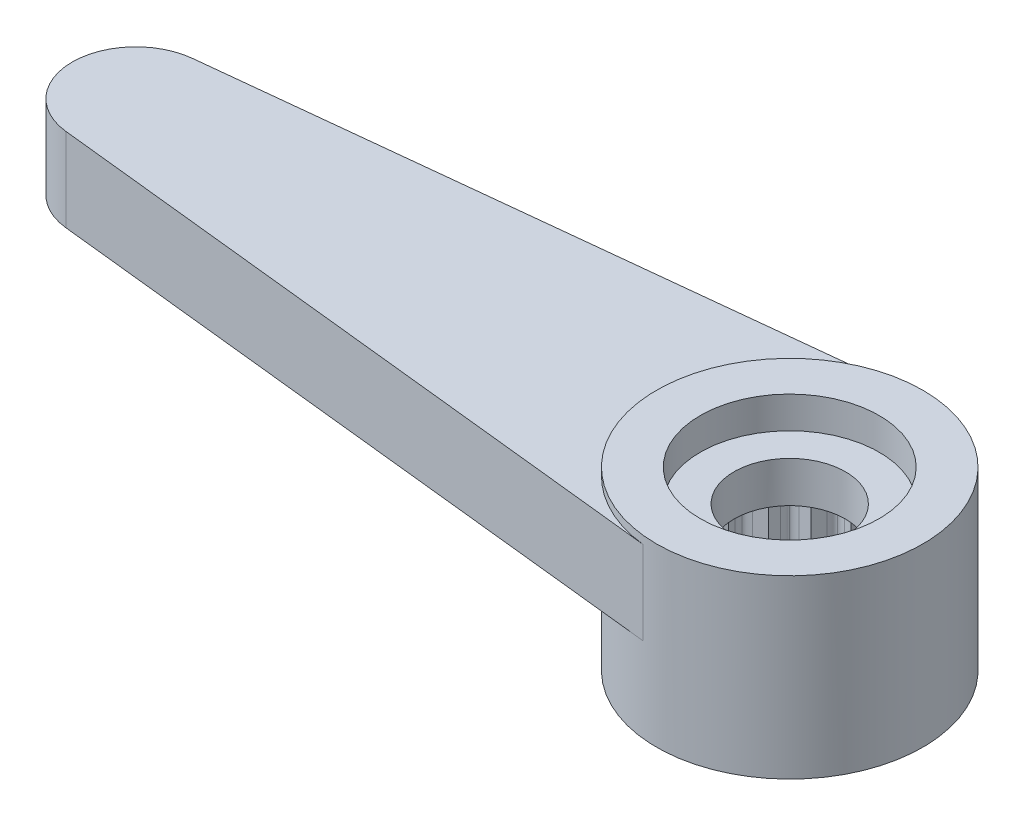
from build123d import *
from build123d.topology import SkipClean

# Parameters (mm, degrees)
BOSS_EXTRUDE1_DEPTH     = 2.1
SKETCH2_R               = 3.35
BOSS_EXTRUDE2_DEPTH     = 0.2
SKETCH3_R               = 2.25
CUT_EXTRUDE1_DEPTH      = 0.8
BOSS_EXTRUDE3_START     = 2.13
SKETCH4_R               = 3.35
BOSS_EXTRUDE3_DEPTH     = 2.13
CUT_EXTRUDE2_DEPTH      = 2.6
CUT_EXTRUDE3_DEPTH      = 14.236835148
CUT_EXTRUDE3_DEPTH_BACK = 14.236835148
SKETCH6_R               = 1.4


with BuildPart() as part:
    # Sketch1 → Boss-Extrude1 (new body)
    with BuildSketch(Plane(origin=(0, 0, 0), x_dir=(1, 0, 0), z_dir=(0, 1, 0))):
        with BuildLine():
            Line((8.51917837, 3.135210257), (-7.744651418, 1.395141105))
            ThreePointArc((-7.744651418, 1.395141105), (-9.174438652, -0.195779262), (-7.744651418, -1.786699629))
            Line((-7.744651418, -1.786699629), (8.51917837, -3.52676878))
            ThreePointArc((8.51917837, -3.52676878), (12.225561348, -0.195779262), (8.51917837, 3.135210257))
        make_face()
    extrude(amount=BOSS_EXTRUDE1_DEPTH)

    # Sketch2 → Boss-Extrude2 (add)
    with BuildSketch(Plane(origin=(0, 2.1, 0), x_dir=(1, 0, 0), z_dir=(0, 1, 0))):
        with Locations(Location((8.875561348, -0.195779262, 0), (0, 0, 96.10685173))):
            Circle(SKETCH2_R)
    extrude(amount=BOSS_EXTRUDE2_DEPTH)

    # Sketch3 → Cut-Extrude1 (cut)
    with BuildSketch(Plane(origin=(0, 2.3, 0), x_dir=(1, 0, 0), z_dir=(0, 1, 0))):
        with Locations(Location((8.875561348, -0.195779262, 0), (0, 0, 270))):
            Circle(SKETCH3_R)
    extrude(amount=-CUT_EXTRUDE1_DEPTH, mode=Mode.SUBTRACT)

    # Sketch4 → Boss-Extrude3 (add)
    with SkipClean():  # the faces are left unmerged after this step: merging them gives an invalid solid
        with BuildSketch(Plane.XZ.offset(BOSS_EXTRUDE3_START)):
            with Locations(Location((8.875561348, 0.195779262, 0), (0, 0, 270))):
                Circle(SKETCH4_R)
        extrude(amount=-BOSS_EXTRUDE3_DEPTH)

    # Sketch5 → Cut-Extrude2 (cut)
    with SkipClean():  # the faces are left unmerged after this step: merging them gives an invalid solid
        with BuildSketch(Plane.XZ.offset(2.13)):
            with BuildLine():
                Line((8.133920562, 2.478314901), (8.301821735, 2.77579771))
                add(Edge.make_bspline(
                    [(8.301821735, 2.77579771), (8.378769734, 2.912132117), (8.445670161, 2.910005398)],
                    knots=[0, 0, 0, 1, 1, 1], degree=2))
                add(Edge.make_bspline(
                    [(8.6239506, 2.82681791), (8.508639056, 2.932701397), (8.445670161, 2.910005398)],
                    knots=[0, 0, 0, 1, 1, 1], degree=2))
                Line((8.6239506, 2.82681791), (8.875561348, 2.595779262))
                Line((8.875561348, 2.595779262), (9.127172097, 2.82681791))
                add(Edge.make_bspline(
                    [(9.127172097, 2.82681791), (9.242483641, 2.932701397), (9.305452536, 2.910005398)],
                    knots=[0, 0, 0, 1, 1, 1], degree=2))
                add(Edge.make_bspline(
                    [(9.449300962, 2.77579771), (9.372352963, 2.912132117), (9.305452536, 2.910005398)],
                    knots=[0, 0, 0, 1, 1, 1], degree=2))
                Line((9.449300962, 2.77579771), (9.617202135, 2.478314901))
                Line((9.617202135, 2.478314901), (9.927893046, 2.620293716))
                add(Edge.make_bspline(
                    [(9.927893046, 2.620293716), (10.070280638, 2.685361669), (10.123154166, 2.644318033)],
                    knots=[0, 0, 0, 1, 1, 1], degree=2))
                add(Edge.make_bspline(
                    [(10.218489692, 2.472227329), (10.187437445, 2.625667294), (10.123154166, 2.644318033)],
                    knots=[0, 0, 0, 1, 1, 1], degree=2))
                Line((10.218489692, 2.472227329), (10.286245954, 2.137420048))
                Line((10.286245954, 2.137420048), (10.625604436, 2.176441154))
                add(Edge.make_bspline(
                    [(10.625604436, 2.176441154), (10.781130186, 2.194324269), (10.818732719, 2.138950633)],
                    knots=[0, 0, 0, 1, 1, 1], degree=2))
                add(Edge.make_bspline(
                    [(10.85622324, 1.945822349), (10.874106355, 2.1013481), (10.818732719, 2.138950633)],
                    knots=[0, 0, 0, 1, 1, 1], degree=2))
                Line((10.85622324, 1.945822349), (10.817202135, 1.606463867))
                Line((10.817202135, 1.606463867), (11.152009415, 1.538707606))
                add(Edge.make_bspline(
                    [(11.152009415, 1.538707606), (11.30544938, 1.507655359), (11.32410012, 1.44337208)],
                    knots=[0, 0, 0, 1, 1, 1], degree=2))
                add(Edge.make_bspline(
                    [(11.300075802, 1.248110959), (11.365143755, 1.390498551), (11.32410012, 1.44337208)],
                    knots=[0, 0, 0, 1, 1, 1], degree=2))
                Line((11.300075802, 1.248110959), (11.158096987, 0.937420048))
                Line((11.158096987, 0.937420048), (11.455579797, 0.769518875))
                add(Edge.make_bspline(
                    [(11.455579797, 0.769518875), (11.591914203, 0.692570876), (11.589787485, 0.625670449)],
                    knots=[0, 0, 0, 1, 1, 1], degree=2))
                add(Edge.make_bspline(
                    [(11.506599997, 0.44739001), (11.612483483, 0.562701554), (11.589787485, 0.625670449)],
                    knots=[0, 0, 0, 1, 1, 1], degree=2))
                Line((11.506599997, 0.44739001), (11.275561348, 0.195779262))
                Line((11.275561348, 0.195779262), (11.506599997, -0.055831487))
                add(Edge.make_bspline(
                    [(11.506599997, -0.055831487), (11.612483483, -0.171143031), (11.589787485, -0.234111926)],
                    knots=[0, 0, 0, 1, 1, 1], degree=2))
                add(Edge.make_bspline(
                    [(11.455579797, -0.377960351), (11.591914203, -0.301012353), (11.589787485, -0.234111926)],
                    knots=[0, 0, 0, 1, 1, 1], degree=2))
                Line((11.455579797, -0.377960351), (11.158096987, -0.545861525))
                Line((11.158096987, -0.545861525), (11.300075802, -0.856552435))
                add(Edge.make_bspline(
                    [(11.300075802, -0.856552435), (11.365143755, -0.998940028), (11.32410012, -1.051813556)],
                    knots=[0, 0, 0, 1, 1, 1], degree=2))
                add(Edge.make_bspline(
                    [(11.152009415, -1.147149082), (11.30544938, -1.116096835), (11.32410012, -1.051813556)],
                    knots=[0, 0, 0, 1, 1, 1], degree=2))
                Line((11.152009415, -1.147149082), (10.817202135, -1.214905344))
                Line((10.817202135, -1.214905344), (10.85622324, -1.554263826))
                add(Edge.make_bspline(
                    [(10.85622324, -1.554263826), (10.874106355, -1.709789576), (10.818732719, -1.747392109)],
                    knots=[0, 0, 0, 1, 1, 1], degree=2))
                add(Edge.make_bspline(
                    [(10.625604436, -1.78488263), (10.781130186, -1.802765745), (10.818732719, -1.747392109)],
                    knots=[0, 0, 0, 1, 1, 1], degree=2))
                Line((10.625604436, -1.78488263), (10.286245954, -1.745861525))
                Line((10.286245954, -1.745861525), (10.218489692, -2.080668805))
                add(Edge.make_bspline(
                    [(10.218489692, -2.080668805), (10.187437445, -2.23410877), (10.123154166, -2.252759509)],
                    knots=[0, 0, 0, 1, 1, 1], degree=2))
                add(Edge.make_bspline(
                    [(9.927893046, -2.228735192), (10.070280638, -2.293803145), (10.123154166, -2.252759509)],
                    knots=[0, 0, 0, 1, 1, 1], degree=2))
                Line((9.927893046, -2.228735192), (9.617202135, -2.086756377))
                Line((9.617202135, -2.086756377), (9.449300962, -2.384239187))
                add(Edge.make_bspline(
                    [(9.449300962, -2.384239187), (9.372352963, -2.520573593), (9.305452536, -2.518446875)],
                    knots=[0, 0, 0, 1, 1, 1], degree=2))
                add(Edge.make_bspline(
                    [(9.127172097, -2.435259387), (9.242483641, -2.541142873), (9.305452536, -2.518446875)],
                    knots=[0, 0, 0, 1, 1, 1], degree=2))
                Line((9.127172097, -2.435259387), (8.875561348, -2.204220738))
                Line((8.875561348, -2.204220738), (8.6239506, -2.435259387))
                add(Edge.make_bspline(
                    [(8.6239506, -2.435259387), (8.508639056, -2.541142873), (8.445670161, -2.518446875)],
                    knots=[0, 0, 0, 1, 1, 1], degree=2))
                add(Edge.make_bspline(
                    [(8.301821735, -2.384239187), (8.378769734, -2.520573593), (8.445670161, -2.518446875)],
                    knots=[0, 0, 0, 1, 1, 1], degree=2))
                Line((8.301821735, -2.384239187), (8.133920562, -2.086756377))
                Line((8.133920562, -2.086756377), (7.823229651, -2.228735192))
                add(Edge.make_bspline(
                    [(7.823229651, -2.228735192), (7.680842059, -2.293803145), (7.62796853, -2.252759509)],
                    knots=[0, 0, 0, 1, 1, 1], degree=2))
                add(Edge.make_bspline(
                    [(7.532633004, -2.080668805), (7.563685251, -2.23410877), (7.62796853, -2.252759509)],
                    knots=[0, 0, 0, 1, 1, 1], degree=2))
                Line((7.532633004, -2.080668805), (7.464876743, -1.745861525))
                Line((7.464876743, -1.745861525), (7.125518261, -1.78488263))
                add(Edge.make_bspline(
                    [(7.125518261, -1.78488263), (6.96999251, -1.802765745), (6.932389977, -1.747392109)],
                    knots=[0, 0, 0, 1, 1, 1], degree=2))
                add(Edge.make_bspline(
                    [(6.894899456, -1.554263826), (6.877016341, -1.709789576), (6.932389977, -1.747392109)],
                    knots=[0, 0, 0, 1, 1, 1], degree=2))
                Line((6.894899456, -1.554263826), (6.933920562, -1.214905344))
                Line((6.933920562, -1.214905344), (6.599113282, -1.147149082))
                add(Edge.make_bspline(
                    [(6.599113282, -1.147149082), (6.445673317, -1.116096835), (6.427022577, -1.051813556)],
                    knots=[0, 0, 0, 1, 1, 1], degree=2))
                add(Edge.make_bspline(
                    [(6.451046894, -0.856552435), (6.385978941, -0.998940028), (6.427022577, -1.051813556)],
                    knots=[0, 0, 0, 1, 1, 1], degree=2))
                Line((6.451046894, -0.856552435), (6.593025709, -0.545861525))
                Line((6.593025709, -0.545861525), (6.2955429, -0.377960351))
                add(Edge.make_bspline(
                    [(6.2955429, -0.377960351), (6.159208493, -0.301012353), (6.161335212, -0.234111926)],
                    knots=[0, 0, 0, 1, 1, 1], degree=2))
                add(Edge.make_bspline(
                    [(6.2445227, -0.055831487), (6.138639213, -0.171143031), (6.161335212, -0.234111926)],
                    knots=[0, 0, 0, 1, 1, 1], degree=2))
                Line((6.2445227, -0.055831487), (6.475561348, 0.195779262))
                Line((6.475561348, 0.195779262), (6.2445227, 0.44739001))
                add(Edge.make_bspline(
                    [(6.2445227, 0.44739001), (6.138639213, 0.562701554), (6.161335212, 0.625670449)],
                    knots=[0, 0, 0, 1, 1, 1], degree=2))
                add(Edge.make_bspline(
                    [(6.2955429, 0.769518875), (6.159208493, 0.692570876), (6.161335212, 0.625670449)],
                    knots=[0, 0, 0, 1, 1, 1], degree=2))
                Line((6.2955429, 0.769518875), (6.593025709, 0.937420048))
                Line((6.593025709, 0.937420048), (6.451046894, 1.248110959))
                add(Edge.make_bspline(
                    [(6.451046894, 1.248110959), (6.385978941, 1.390498551), (6.427022577, 1.44337208)],
                    knots=[0, 0, 0, 1, 1, 1], degree=2))
                add(Edge.make_bspline(
                    [(6.599113282, 1.538707606), (6.445673317, 1.507655359), (6.427022577, 1.44337208)],
                    knots=[0, 0, 0, 1, 1, 1], degree=2))
                Line((6.599113282, 1.538707606), (6.933920562, 1.606463867))
                Line((6.933920562, 1.606463867), (6.894899456, 1.945822349))
                add(Edge.make_bspline(
                    [(6.894899456, 1.945822349), (6.877016341, 2.1013481), (6.932389977, 2.138950633)],
                    knots=[0, 0, 0, 1, 1, 1], degree=2))
                add(Edge.make_bspline(
                    [(7.125518261, 2.176441154), (6.96999251, 2.194324269), (6.932389977, 2.138950633)],
                    knots=[0, 0, 0, 1, 1, 1], degree=2))
                Line((7.125518261, 2.176441154), (7.464876743, 2.137420048))
                Line((7.464876743, 2.137420048), (7.532633004, 2.472227329))
                add(Edge.make_bspline(
                    [(7.532633004, 2.472227329), (7.563685251, 2.625667294), (7.62796853, 2.644318033)],
                    knots=[0, 0, 0, 1, 1, 1], degree=2))
                add(Edge.make_bspline(
                    [(7.823229651, 2.620293716), (7.680842059, 2.685361669), (7.62796853, 2.644318033)],
                    knots=[0, 0, 0, 1, 1, 1], degree=2))
                Line((7.823229651, 2.620293716), (8.133920562, 2.478314901))
            make_face()
        extrude(amount=-CUT_EXTRUDE2_DEPTH, mode=Mode.SUBTRACT)

    # Sketch6 → Cut-Extrude3 (cut, two sides: drawn at the far end of the back side and taken through both)
    with SkipClean():  # the faces are left unmerged after this step: merging them gives an invalid solid
        with BuildSketch(Plane(origin=(0, 1.5, 0), x_dir=(1, 0, 0), z_dir=(0, 1, 0)).offset(-CUT_EXTRUDE3_DEPTH_BACK)):
            with Locations(Location((8.875561348, -0.195779262, 0), (0, 0, 270))):
                Circle(SKETCH6_R)
        extrude(amount=CUT_EXTRUDE3_DEPTH + CUT_EXTRUDE3_DEPTH_BACK, mode=Mode.SUBTRACT)


solid = part.part
